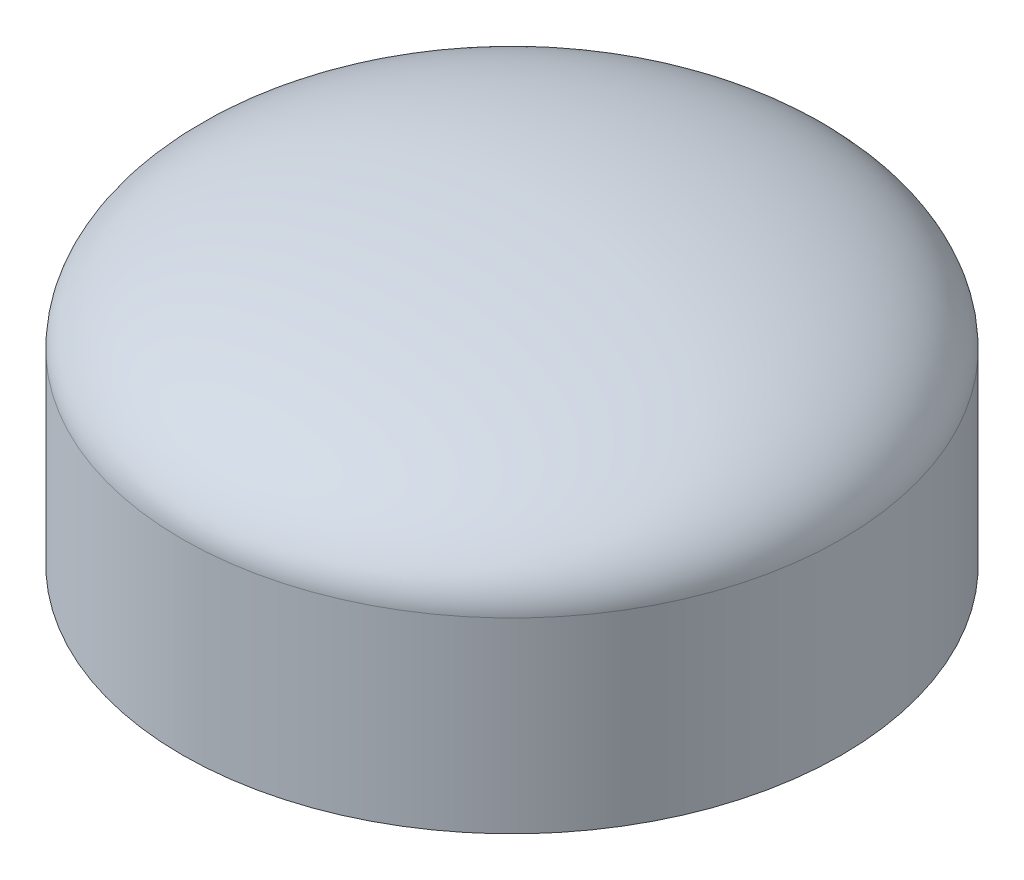
from build123d import *


with BuildPart() as part:
    # Sketch1 → Revolve1 (revolve)
    with BuildSketch(Plane.XY):
        with BuildLine():
            Line((41.1, 0), (41.1, 25))
            add(Edge.make_bspline(
                [(41.1, 25), (41.1, 38), (0, 38)],
                knots=[0, 0, 0, 1.570796327, 1.570796327, 1.570796327], degree=2, weights=[1, 0.707106781, 1]))
            Line((0, 38), (0, 41))
            add(Edge.make_bspline(
                [(44.1, 25), (44.1, 41), (0, 41)],
                knots=[0, 0, 0, 1.570796327, 1.570796327, 1.570796327], degree=2, weights=[1, 0.707106781, 1]))
            Line((44.1, 25), (44.1, 0))
            Line((44.1, 0), (41.1, 0))
        make_face()
    revolve(axis=Axis((0, 38, 0), (0, 1, 0)))


solid = part.part
